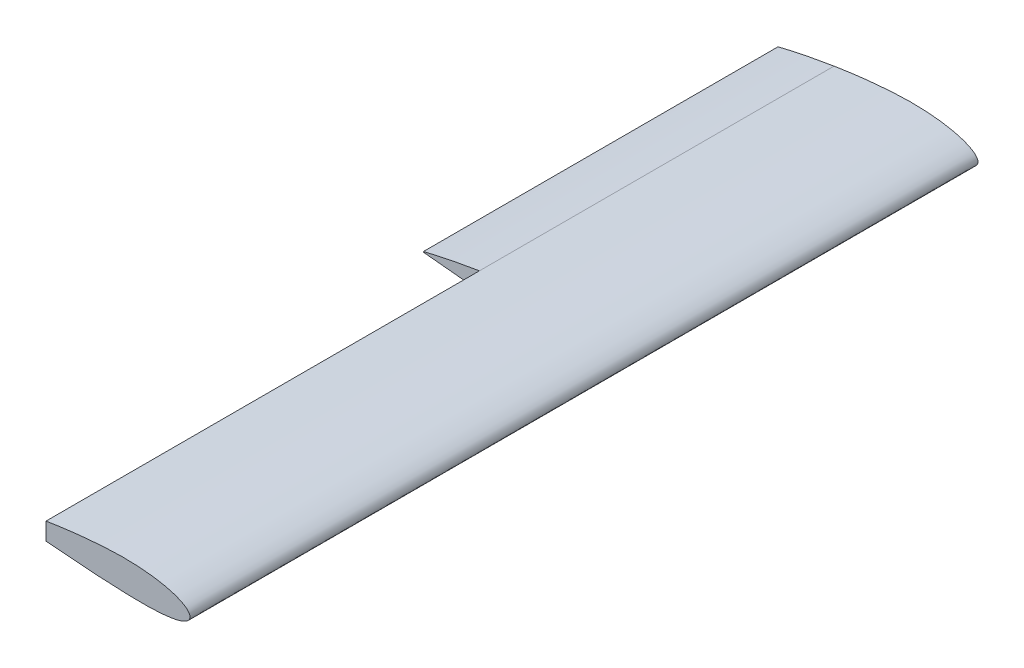
from build123d import *

# Parameters (mm, degrees)
BOSS_EXTRUDE1_DEPTH = 1120
BOSS_EXTRUDE2_DEPTH = 504
SKETCH3_R           = 12.7
CUT_EXTRUDE1_DEPTH  = 801
SKETCH4_W           = 32
SKETCH4_H           = 38.019
CUT_EXTRUDE2_DEPTH  = 46
SKETCH5_W           = 60
SKETCH5_H           = 12
CUT_EXTRUDE3_DEPTH  = 46
SKETCH6_W           = 54
SKETCH6_H           = 29.1
CUT_EXTRUDE4_DEPTH  = 64
SKETCH7_W           = 20.4
SKETCH7_H           = 6.8
CUT_EXTRUDE5_DEPTH  = 26


with BuildPart() as part:
    # Sketch1 → Boss-Extrude1 (new body)
    with BuildSketch(Plane.XY):
        with BuildLine():
            Line((-204.60672, 16.43373442), (-204.60672, -8.19868247))
            add(Edge.make_bspline(
                [(-204.60672, 16.43373442), (-202.036361523, 16.843517491), (-195.976847624, 17.809564148), (-186.31991623, 19.219612694), (-175.572173627, 20.681898456), (-164.607311335, 22.038583826), (-153.49404645, 23.271644216), (-142.301458132, 24.357624452), (-131.099746315, 25.27611377), (-119.943510485, 26.006687445), (-108.882401137, 26.537168758), (-97.984658952, 26.784601367), (-87.339197239, 26.746452246), (-77.037775283, 26.416865966), (-67.149643376, 25.798512435), (-57.741129063, 24.898884792), (-48.874997943, 23.731117117), (-40.609751299, 22.313467309), (-32.99899187, 20.668813467), (-26.09083036, 18.823819721), (-19.927325542, 16.807846118), (-14.543890216, 14.651588692), (-9.968619512, 12.385203852), (-6.221379001, 10.035790246), (-3.313738727, 7.621930176), (-1.252844721, 5.146672973), (-0.067461683, 2.586657871), (0.154594698, -0.015527038), (-0.577602024, -2.520166193), (-2.23111232, -4.795683741), (-4.705066866, -6.827199984), (-7.969820634, -8.652738302), (-12.011996138, -10.283908092), (-16.812796605, -11.721159399), (-22.346009478, -12.960758117), (-28.579355048, -13.999351597), (-35.475903212, -14.835557319), (-42.995015776, -15.470938778), (-51.09296977, -15.910485811), (-59.723361484, -16.162845606), (-68.837366971, -16.240282897), (-78.383909857, -16.158476575), (-88.309752455, -15.935832899), (-98.559621371, -15.593680374), (-109.096656126, -15.151303304), (-119.877295693, -14.638508478), (-130.835253322, -14.00930548), (-141.884466391, -13.29005991), (-152.942439018, -12.499573468), (-163.942262105, -11.656685653), (-174.816986108, -10.778505542), (-185.49994365, -9.879627403), (-195.408852603, -9.021145417), (-201.74858929, -8.4542533), (-204.60672, -8.19868247)],
                knots=[0, 0, 0, 0, 0.018424224, 0.043434346, 0.069080412, 0.095203092, 0.121640117, 0.148227444, 0.17480049, 0.201195447, 0.227363977, 0.253181792, 0.278347264, 0.302710399, 0.326128333, 0.348466602, 0.369600377, 0.389415723, 0.407811011, 0.424698681, 0.44000774, 0.453687637, 0.465714725, 0.476103672, 0.484928355, 0.492360154, 0.498730164, 0.504586951, 0.510443348, 0.516803825, 0.524198712, 0.532940661, 0.543185695, 0.554995644, 0.568376342, 0.583298542, 0.599709376, 0.617538825, 0.636703502, 0.65710892, 0.678650912, 0.701216586, 0.724685048, 0.748928058, 0.7738107, 0.799337901, 0.825325561, 0.851504471, 0.877716004, 0.903800001, 0.929595993, 0.954944401, 0.979687675, 1, 1, 1, 1], degree=3))
        make_face()
    extrude(amount=BOSS_EXTRUDE1_DEPTH)

    # Sketch2 → Boss-Extrude2 (add)
    with BuildSketch(Plane.XY):
        with BuildLine():
            Line((-204.60672, 16.43373442), (-204.60672, -8.19868247))
            add(Edge.make_bspline(
                [(-204.60672, -8.19868247), (-205.123341506, -8.152765503), (-208.886818398, -7.818270242), (-215.747067479, -7.19031909), (-225.019618317, -6.332407693), (-233.78771967, -5.505552256), (-241.996048886, -4.719294865), (-249.592303574, -3.980104608), (-256.527861477, -3.294772313), (-262.75808282, -2.6700791), (-268.242600782, -2.111780911), (-272.945834404, -1.62819317), (-276.836698489, -1.219072845), (-279.890503934, -0.906023665), (-282.084971372, -0.653321358), (-283.409976301, -0.546659805), (-284.007600869, -0.445986487), (-284.166073983, -0.446550556), (-284.176, -0.446585887)],
                knots=[0, 0, 0, 0, 0.019462551, 0.14178051, 0.258505433, 0.368899529, 0.472261554, 0.567931303, 0.655293986, 0.733784513, 0.802891701, 0.862162346, 0.911205133, 0.949694244, 0.977372582, 0.994054454, 0.999627599, 1, 1, 1, 1], degree=3))
            Line((-284.176, -0.446585887), (-284.176, 0.453857008))
            add(Edge.make_bspline(
                [(-204.60672, 16.43373442), (-205.415471282, 16.307052878), (-209.473007674, 15.671486692), (-216.612776575, 14.457484774), (-225.855570238, 12.827283141), (-234.573734516, 11.204003783), (-242.71639827, 9.620137001), (-250.234645079, 8.09672624), (-257.084002847, 6.657250954), (-263.224123157, 5.323917782), (-268.619097463, 4.118109632), (-273.237578469, 3.059759971), (-277.052897898, 2.166891113), (-280.043162129, 1.455156879), (-282.19127614, 0.937226778), (-283.475130043, 0.62509225), (-284.041595768, 0.4866944), (-284.176, 0.453857008)],
                knots=[0, 0, 0, 0, 0.030251696, 0.151773928, 0.267626296, 0.377089872, 0.479484952, 0.574174897, 0.660569789, 0.738129949, 0.806369318, 0.864858701, 0.913228834, 0.951173208, 0.978450569, 0.994887008, 1, 1, 1, 1], degree=3))
        make_face()
    extrude(amount=BOSS_EXTRUDE2_DEPTH)

    # Sketch3 → Cut-Extrude1 (cut)
    with BuildSketch(Plane.XY):
        with Locations((-85.253, 5.328)):
            Circle(SKETCH3_R)
    extrude(amount=CUT_EXTRUDE1_DEPTH, mode=Mode.SUBTRACT)

    # Sketch4 → Cut-Extrude2 (cut)
    with BuildSketch(Plane.XY.offset(330.7)):
        with Locations((-85.253, 2.0185)):
            Rectangle(SKETCH4_W, SKETCH4_H)
    extrude(amount=CUT_EXTRUDE2_DEPTH, mode=Mode.SUBTRACT)

    # Sketch5 → Cut-Extrude3 (cut)
    with BuildSketch(Plane.XY.offset(330.7)):
        with Locations((-227.3408, -2.16)):
            Rectangle(SKETCH5_W, SKETCH5_H)
    extrude(amount=CUT_EXTRUDE3_DEPTH, mode=Mode.SUBTRACT)

    # Sketch6 → Cut-Extrude4 (cut)
    with BuildSketch(Plane.XY.offset(534.5)):
        with Locations((-156.297, -0.714)):
            Rectangle(SKETCH6_W, SKETCH6_H)
    extrude(amount=CUT_EXTRUDE4_DEPTH, mode=Mode.SUBTRACT)

    # Sketch7 → Cut-Extrude5 (cut)
    with BuildSketch(Plane.XY.offset(-0.5)):
        with Locations((-198.923, 4.263)):
            Rectangle(SKETCH7_W, SKETCH7_H)
    extrude(amount=CUT_EXTRUDE5_DEPTH, mode=Mode.SUBTRACT)


solid = part.part
